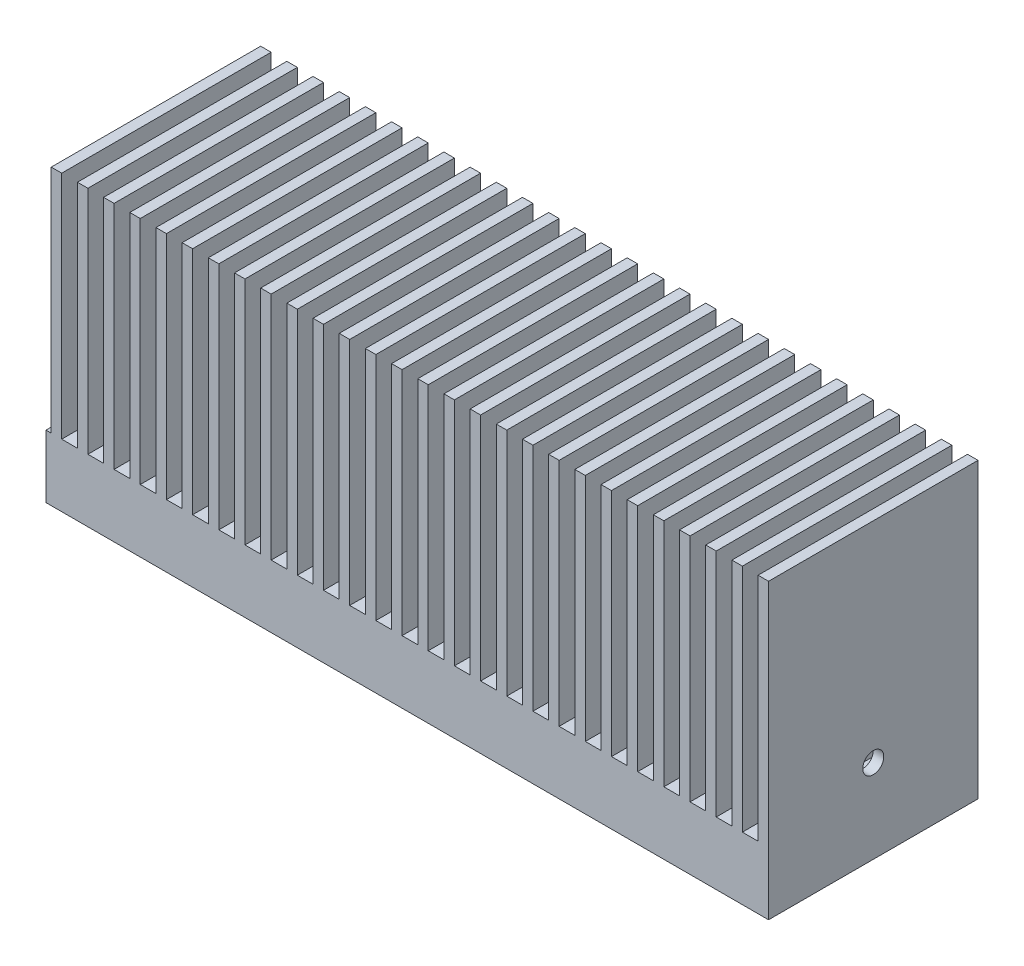
from build123d import *

# Parameters (mm, degrees)
SKETCH_1_W          = 69
SKETCH_1_H          = 20
EXTRUDE_1_DEPTH     = 28
SKETCH_2_W          = 1.5
SKETCH_2_H          = 20
CUT_EXTRUDE_1_DEPTH = 22
SKETCH_3_R          = 1
CUT_EXTRUDE_2_DEPTH = 5
CUT_EXTRUDE_START   = -5
SKETCH_4_R          = 1
CUT_EXTRUDE_3_DEPTH = 5


with BuildPart() as part:
    # 草图1 → 拉伸1 (new body)
    with BuildSketch(Plane(origin=(0, 0, 0), x_dir=(1, 0, 0), z_dir=(0, 1, 0))):
        Rectangle(SKETCH_1_W, SKETCH_1_H)
    extrude(amount=EXTRUDE_1_DEPTH)

    # 草图2 → 切除-拉伸1 (cut)
    with BuildSketch(Plane(origin=(0, 28, 0), x_dir=(-1, 0, 0), z_dir=(0, 1, 0))):
        with Locations((-0.25, 0)):
            Rectangle(SKETCH_2_W, SKETCH_2_H)
        with Locations((2.25, 0)):
            Rectangle(SKETCH_2_W, SKETCH_2_H)
        with Locations((4.75, 0)):
            Rectangle(SKETCH_2_W, SKETCH_2_H)
        with Locations((7.25, 0)):
            Rectangle(SKETCH_2_W, SKETCH_2_H)
        with Locations((9.75, 0)):
            Rectangle(SKETCH_2_W, SKETCH_2_H)
        with Locations((12.25, 0)):
            Rectangle(SKETCH_2_W, SKETCH_2_H)
        with Locations((14.75, 0)):
            Rectangle(SKETCH_2_W, SKETCH_2_H)
        with Locations((17.25, 0)):
            Rectangle(SKETCH_2_W, SKETCH_2_H)
        with Locations((19.75, 0)):
            Rectangle(SKETCH_2_W, SKETCH_2_H)
        with Locations((22.25, 0)):
            Rectangle(SKETCH_2_W, SKETCH_2_H)
        with Locations((24.75, 0)):
            Rectangle(SKETCH_2_W, SKETCH_2_H)
        with Locations((27.25, 0)):
            Rectangle(SKETCH_2_W, SKETCH_2_H)
        with Locations((29.75, 0)):
            Rectangle(SKETCH_2_W, SKETCH_2_H)
        with Locations((32.25, 0)):
            Rectangle(SKETCH_2_W, SKETCH_2_H)
        with Locations((34.75, 0)):
            Rectangle(SKETCH_2_W, SKETCH_2_H)
        with Locations((-2.75, 0)):
            Rectangle(SKETCH_2_W, SKETCH_2_H)
        with Locations((-5.25, 0)):
            Rectangle(SKETCH_2_W, SKETCH_2_H)
        with Locations((-7.75, 0)):
            Rectangle(SKETCH_2_W, SKETCH_2_H)
        with Locations((-10.25, 0)):
            Rectangle(SKETCH_2_W, SKETCH_2_H)
        with Locations((-12.75, 0)):
            Rectangle(SKETCH_2_W, SKETCH_2_H)
        with Locations((-15.25, 0)):
            Rectangle(SKETCH_2_W, SKETCH_2_H)
        with Locations((-17.75, 0)):
            Rectangle(SKETCH_2_W, SKETCH_2_H)
        with Locations((-20.25, 0)):
            Rectangle(SKETCH_2_W, SKETCH_2_H)
        with Locations((-22.75, 0)):
            Rectangle(SKETCH_2_W, SKETCH_2_H)
        with Locations((-25.25, 0)):
            Rectangle(SKETCH_2_W, SKETCH_2_H)
        with Locations((-27.75, 0)):
            Rectangle(SKETCH_2_W, SKETCH_2_H)
        with Locations((-30.25, 0)):
            Rectangle(SKETCH_2_W, SKETCH_2_H)
        with Locations((-32.75, 0)):
            Rectangle(SKETCH_2_W, SKETCH_2_H)
    extrude(amount=-CUT_EXTRUDE_1_DEPTH, mode=Mode.SUBTRACT)

    # 草图3 → 切除-拉伸2 (cut)
    with BuildSketch(Plane.ZY.offset(34)):
        with Locations((0, 8)):
            Circle(SKETCH_3_R)
    extrude(amount=-CUT_EXTRUDE_2_DEPTH, mode=Mode.SUBTRACT)

    # 草图4 → 切除-拉伸3 (cut)
    with BuildSketch(Plane(origin=(34.5, 0, 0), x_dir=(0, 0, -1), z_dir=(1, 0, 0)).offset(CUT_EXTRUDE_START)):
        with Locations(Location((0, 8, 0), (0, 0, 180))):
            Circle(SKETCH_4_R)
    extrude(amount=CUT_EXTRUDE_3_DEPTH, mode=Mode.SUBTRACT)


solid = part.part
